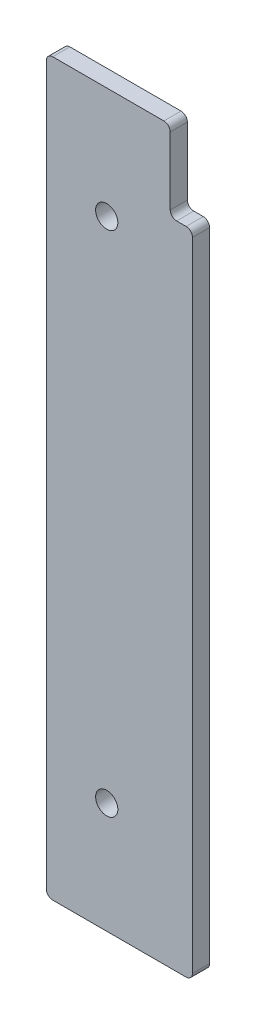
from build123d import *

# Parameters (mm, degrees)
SKETCH1_R           = 1.75
BOSS_EXTRUDE1_DEPTH = 2.7


with BuildPart() as part:
    # Sketch1 → Boss-Extrude1 (new body)
    with BuildSketch(Plane.XY):
        with BuildLine():
            Line((142.5, 205.819306835), (141, 205.819306835))
            ThreePointArc((141, 205.819306835), (140.292893219, 206.112200054), (140, 206.819306835))
            Line((140, 206.819306835), (140, 217.457909006))
            ThreePointArc((140, 217.457909006), (139.707106781, 218.165015787), (139, 218.457909006))
            Line((139, 218.457909006), (121.5, 218.457909006))
            ThreePointArc((121.5, 218.457909006), (120.792893219, 218.165015787), (120.5, 217.457909006))
            Line((120.5, 217.457909006), (120.5, 104.457909006))
            ThreePointArc((120.5, 104.457909006), (120.792893219, 103.750802225), (121.5, 103.457909006))
            Line((121.5, 103.457909006), (142.5, 103.457909006))
            ThreePointArc((142.5, 103.457909006), (143.207106781, 103.750802225), (143.5, 104.457909006))
            Line((143.5, 104.457909006), (143.5, 204.819306835))
            ThreePointArc((143.5, 204.819306835), (143.207106781, 205.526413617), (142.5, 205.819306835))
        make_face()
        with Locations(Location((130, 200.941258447, 0), (0, 0, 180))):
            Circle(SKETCH1_R, mode=Mode.SUBTRACT)
        with Locations(Location((130, 120.941258447, 0), (0, 0, 180))):
            Circle(SKETCH1_R, mode=Mode.SUBTRACT)
    extrude(amount=BOSS_EXTRUDE1_DEPTH)


solid = part.part
